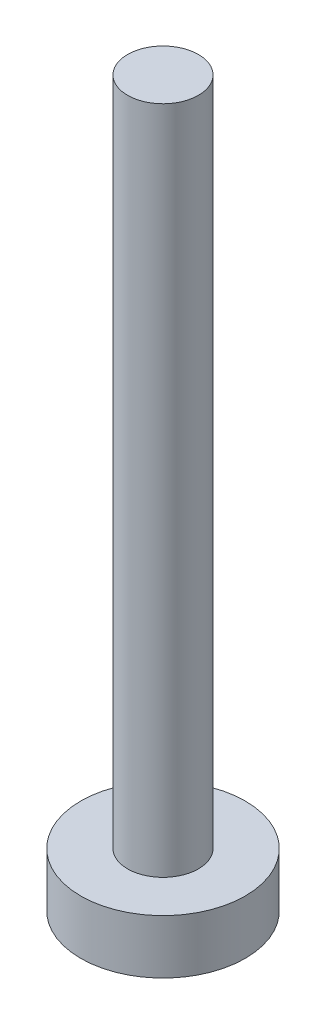
from build123d import *

# Parameters (mm, degrees)
SKETCH1_R           = 1.46
BOSS_EXTRUDE1_DEPTH = 0.96
SKETCH2_R           = 0.628287376
BOSS_EXTRUDE2_DEPTH = 12.85


with BuildPart() as part:
    # Sketch1 → Boss-Extrude1 (new body)
    with BuildSketch(Plane(origin=(0, 0, 0), x_dir=(1, 0, 0), z_dir=(0, 1, 0))):
        with Locations(Location((0, 0, 0), (0, 0, 270))):
            Circle(SKETCH1_R)
    extrude(amount=BOSS_EXTRUDE1_DEPTH)

    # Sketch2 → Boss-Extrude2 (add)
    with BuildSketch(Plane.XZ):
        with Locations(Location((0, 0, 0), (0, 0, 270))):
            Circle(SKETCH2_R)
    extrude(amount=-BOSS_EXTRUDE2_DEPTH)


solid = part.part
